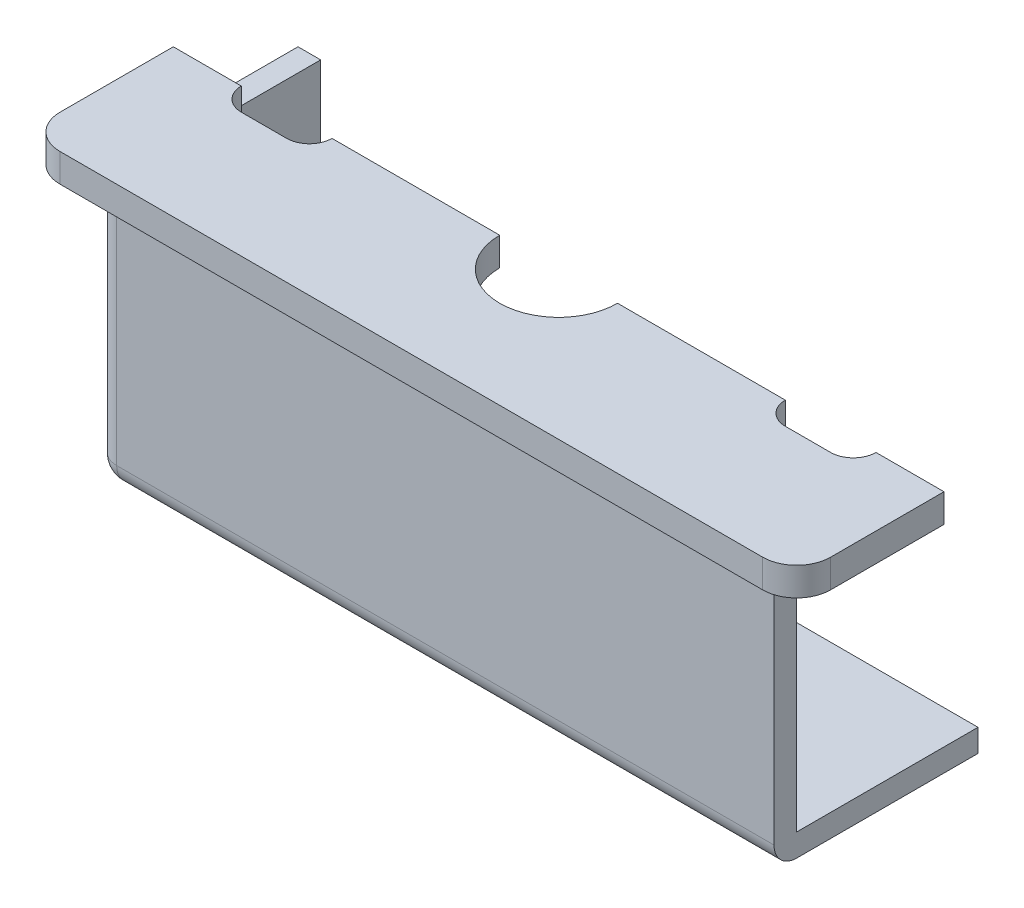
from build123d import *

# Parameters (mm, degrees)
SKETCH_1_W          = 30
SKETCH_1_H          = 9
EXTRUDE_3_DEPTH     = 12
SKETCH_5_W          = 29
SKETCH_5_H          = 8
CUT_EXTRUDE_4_DEPTH = 11
EXTRUDE_5_DEPTH     = 1.25
FILLET_4_R          = 1


with BuildPart() as part:
    # 草图1 → 凸台-拉伸3 (new body)
    with BuildSketch(Plane(origin=(0, 0, 0), x_dir=(1, 0, 0), z_dir=(0, 1, 0))):
        with Locations((-0.5, -0.5)):
            Rectangle(SKETCH_1_W, SKETCH_1_H)
    extrude(amount=-EXTRUDE_3_DEPTH)

    # 草图5 → 切除-拉伸4 (cut)
    with BuildSketch(Plane(origin=(0, 0, 0), x_dir=(1, 0, 0), z_dir=(0, 1, 0))):
        Rectangle(SKETCH_5_W, SKETCH_5_H)
    extrude(amount=-CUT_EXTRUDE_4_DEPTH, mode=Mode.SUBTRACT)

    # 草图6 → 凸台-拉伸5 (add)
    with BuildSketch(Plane(origin=(0, 0, 0), x_dir=(1, 0, 0), z_dir=(0, 1, 0))):
        with BuildLine():
            Line((-17, 0), (-14, 0))
            ThreePointArc((-14, 0), (-13.707106781, -0.707106781), (-13, -1))
            Line((-13, -1), (-11, -1))
            ThreePointArc((-11, -1), (-10.292893219, -0.707106781), (-10, 0))
            Line((-10, 0), (-2.6, 0))
            ThreePointArc((-2.6, 0), (0, -2.6), (2.6, 0))
            Line((2.6, 0), (10, 0))
            ThreePointArc((10, 0), (10.292893219, -0.707106781), (11, -1))
            Line((11, -1), (13, -1))
            ThreePointArc((13, -1), (13.707106781, -0.707106781), (14, 0))
            Line((14, 0), (17, 0))
            Line((17, 0), (17, -5))
            ThreePointArc((17, -5), (16.560660172, -6.060660172), (15.5, -6.5))
            Line((15.5, -6.5), (-15.5, -6.5))
            ThreePointArc((-15.5, -6.5), (-16.560660172, -6.060660172), (-17, -5))
            Line((-17, -5), (-17, 0))
        make_face()
    extrude(amount=EXTRUDE_5_DEPTH)

    # 圆角4
    fillet_4_edges = [part.edges().sort_by_distance(p)[0] for p in [
        (-15.5, -12, 0.5),
        (-0.5, -12, 5),
        (-15.5, -6, 5),
    ]]
    fillet(fillet_4_edges, radius=FILLET_4_R)


solid = part.part
